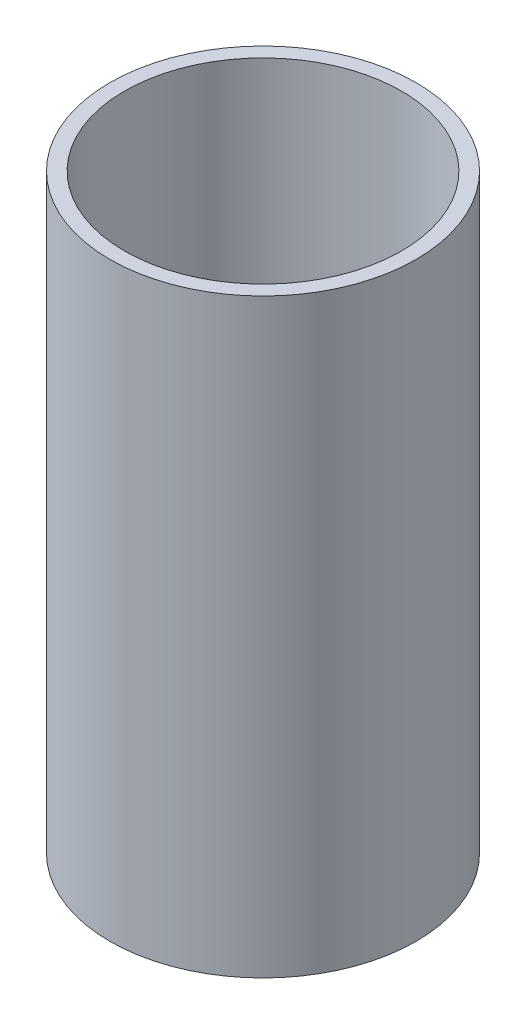
from build123d import *

# Parameters (mm, degrees)
SKETCH1_R           = 10.5
BOSS_EXTRUDE1_DEPTH = 40.5
SHELL1_T            = -1


with BuildPart() as part:
    # Sketch1 → Boss-Extrude1 (new body)
    with BuildSketch(Plane(origin=(0, 0, 0), x_dir=(1, 0, 0), z_dir=(0, 1, 0))):
        with Locations(Location((0, 0, 0), (0, 0, 270))):
            Circle(SKETCH1_R)
    extrude(amount=BOSS_EXTRUDE1_DEPTH)

    # Shell1
    shell1_openings = [part.faces().sort_by_distance(p)[0] for p in [
        (0, 40.5, 0),
    ]]
    offset(amount=SHELL1_T, openings=shell1_openings, kind=Kind.INTERSECTION)


solid = part.part
